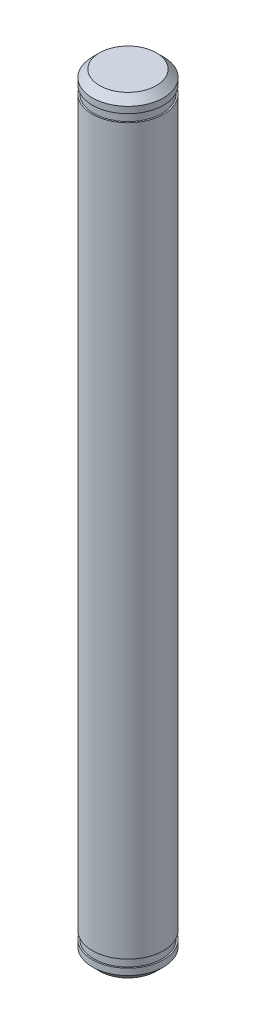
from build123d import *

# Parameters (mm, degrees)
CHAMFER_1_SIZE      = 1
CUT_EXTRUDE_START   = -3
SKETCH_2_R          = 5
SKETCH_2_R_2        = 4.8
CUT_EXTRUDE_1_DEPTH = 1.1


with BuildPart() as part:
    # 草图1 → 旋转1 (revolve)
    with BuildSketch(Plane.XY, mode=Mode.PRIVATE) as revolve_1_sk:
        Polygon((0, 54), (5, 54), (5, 15), (5, -15), (5, -54), (0, -54), align=None)
    revolve(revolve_1_sk.sketch.rotate(Axis((0, 54, 0), (0, -1, 0)), 180), axis=Axis((0, 54, 0), (0, -1, 0)))

    # 倒角1
    chamfer_1_edges = [part.edges().sort_by_distance(p)[0] for p in [
        (5, -54, 0),
        (5, 54, 0),
    ]]
    chamfer(chamfer_1_edges, length=CHAMFER_1_SIZE)

    # 草图2 → 切除-拉伸1 (cut)
    with BuildSketch(Plane(origin=(0, 54, 0), x_dir=(1, 0, 0), z_dir=(0, 1, 0)).offset(CUT_EXTRUDE_START)):
        with Locations(Location((0, 0, 0), (0, 0, 180))):
            Circle(SKETCH_2_R)
        with Locations(Location((0, 0, 0), (0, 0, 180))):
            Circle(SKETCH_2_R_2, mode=Mode.SUBTRACT)
    cut_extrude_1 = extrude(amount=CUT_EXTRUDE_1_DEPTH, mode=Mode.SUBTRACT)

    # 镜向1: 切除-拉伸1 across plane
    add(cut_extrude_1.mirror(Plane.ZX), mode=Mode.SUBTRACT)


solid = part.part
